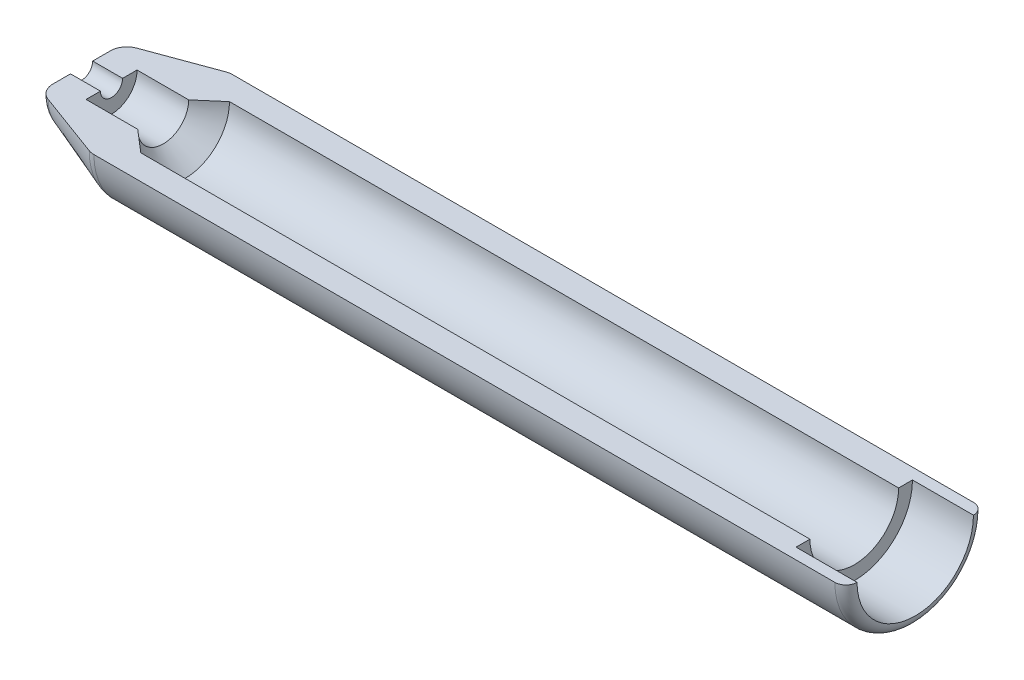
from build123d import *

# Parameters (mm, degrees)
REVOLVE1_ANGLE = 180


with BuildPart() as part:
    # Sketch1 → Revolve1 (revolve)
    with BuildSketch(Plane(origin=(0, 0, 0), x_dir=(1, 0, 0), z_dir=(0, 1, 0))):
        with BuildLine():
            Line((-2.426089026, 0.9), (-1.253621619, 1.331536072))
            ThreePointArc((-1.253621619, 1.331536072), (-1.202626886, 1.345347949), (-1.15, 1.35))
            Line((-1.15, 1.35), (12.217609628, 1.35))
            ThreePointArc((12.217609628, 1.35), (12.359030984, 1.291421356), (12.417609628, 1.15))
            Line((12.417609628, 1.15), (11.317609628, 1.15))
            Line((11.317609628, 1.15), (11.317609628, 0.9))
            Line((11.317609628, 0.9), (3.617609628, 0.9))
            Line((3.617609628, 0.9), (2.917609628, 0.9))
            Line((2.917609628, 0.9), (-0.754449261, 0.9))
            Line((-0.754449261, 0.9), (-1.15, 0.56))
            Line((-1.15, 0.56), (-2.082390372, 0.56))
            Line((-2.082390372, 0.56), (-2.082390372, 0.3))
            Line((-2.082390372, 0.3), (-2.622467407, 0.3))
            Line((-2.622467407, 0.3), (-2.622467407, 0.618463928))
            ThreePointArc((-2.622467407, 0.618463928), (-2.568522772, 0.790093637), (-2.426089026, 0.9))
        make_face()
    revolve(axis=Axis((-3.185032955, 0, -0.1), (-1, 0, 0)), revolution_arc=REVOLVE1_ANGLE)


solid = part.part
